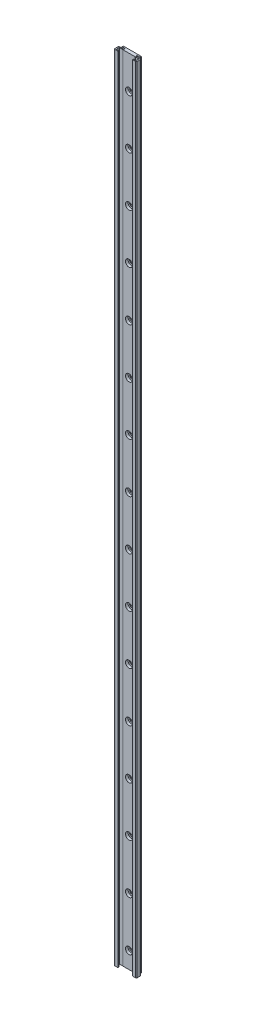
from build123d import *

# Parameters (mm, degrees)
BOSS_EXTRU_1_DEPTH                                 = 960
ENL_V_MAT_EXTRU_1_DEPTH                            = 961.134334351
DIAM_TRE_DU_PER_AGE_0_4_0_4_1_D                    = 0.4
CHAMBRAGE_POUR_VIS_T_TE_HEXAGONALE_M41_D           = 4.5
CHAMBRAGE_POUR_VIS_T_TE_HEXAGONALE_M41_CBORE_D     = 8.5
CHAMBRAGE_POUR_VIS_T_TE_HEXAGONALE_M41_CBORE_DEPTH = 3.1
CONG_1_R                                           = 0.2
CONG_2_R                                           = 0.5
CONG_3_R                                           = 1
R_P_TITION_LIN_AIRE1_COUNT                         = 16
R_P_TITION_LIN_AIRE1_PITCH                         = 60


with BuildPart() as part:
    # Esquisse1 → Boss.-Extru.1 (new body)
    with BuildSketch(Plane.XZ):
        with BuildLine():
            Line((13.5, 3), (13.5, 8.7))
            Line((13.5, 8.7), (-13.5, 8.7))
            Line((-13.5, 8.7), (-13.5, 3))
            Line((-13.5, 3), (-7.8, 3))
            ThreePointArc((-7.8, 3), (-7.05, 2.25), (-7.8, 1.5))
            Line((-7.8, 1.5), (-11, 1.5))
            Line((-11, 1.5), (-11, 0))
            Line((-11, 0), (11, 0))
            Line((11, 0), (11, 1.5))
            Line((11, 1.5), (7.8, 1.5))
            ThreePointArc((7.8, 1.5), (7.05, 2.25), (7.8, 3))
            Line((7.8, 3), (13.5, 3))
        make_face()
    extrude(amount=-BOSS_EXTRU_1_DEPTH)

    # Esquisse2 → Enlèv. mat.-Extru.1 (cut, through all)
    with BuildSketch(Plane(origin=(0, 960, 0), x_dir=(-1, 0, 0), z_dir=(0, 1, 0))):
        Polygon((8.75, 8.7), (-8.75, 8.7), (-8.75, 7.6), (-12, 7.6), (-12, 4.1), (12, 4.1), (12, 7.6), (8.75, 7.6), align=None)
    extrude(amount=-ENL_V_MAT_EXTRU_1_DEPTH, mode=Mode.SUBTRACT)

    # Diamètre du perçage Ø0.4 (0.4)1 (through all)
    with Locations(Plane(origin=(0, 0, 0), x_dir=(-1, 0, 0), z_dir=(0, -1, 0))):
        with Locations((7.75, -4.1), (-7.75, -4.1)):
            Hole(DIAM_TRE_DU_PER_AGE_0_4_0_4_1_D / 2)

    # Chambrage pour vis à tête hexagonale M41 (through all)
    with Locations(Plane.XY.offset(4.1)):
        with Locations((0, 20), (0, 80)):
            chambrage_pour_vis_t_te_hexagonale_m41 = CounterBoreHole(CHAMBRAGE_POUR_VIS_T_TE_HEXAGONALE_M41_D / 2, CHAMBRAGE_POUR_VIS_T_TE_HEXAGONALE_M41_CBORE_D / 2, CHAMBRAGE_POUR_VIS_T_TE_HEXAGONALE_M41_CBORE_DEPTH)

    # Congé1
    cong_1_edges = [part.edges().sort_by_distance(p)[0] for p in [
        (11, 480, 1.5),
        (-11, 480, 1.5),
    ]]
    fillet(cong_1_edges, radius=CONG_1_R)

    # Congé2
    cong_2_edges = [part.edges().sort_by_distance(p)[0] for p in [
        (-12, 480, 7.6),
        (-12, 480, 4.1),
        (12, 480, 4.1),
        (12, 480, 7.6),
    ]]
    fillet(cong_2_edges, radius=CONG_2_R)

    # Congé3
    cong_3_edges = [part.edges().sort_by_distance(p)[0] for p in [
        (-13.5, 480, 3),
        (-13.5, 480, 8.7),
        (13.5, 480, 8.7),
        (13.5, 480, 3),
    ]]
    fillet(cong_3_edges, radius=CONG_3_R)

    # Répétition linéaire1: Chambrage pour vis à tête hexagonale M41 ×16
    with Locations(*[(0, i * R_P_TITION_LIN_AIRE1_PITCH, 0) for i in range(1, R_P_TITION_LIN_AIRE1_COUNT)]):
        add(chambrage_pour_vis_t_te_hexagonale_m41, mode=Mode.SUBTRACT)


solid = part.part
